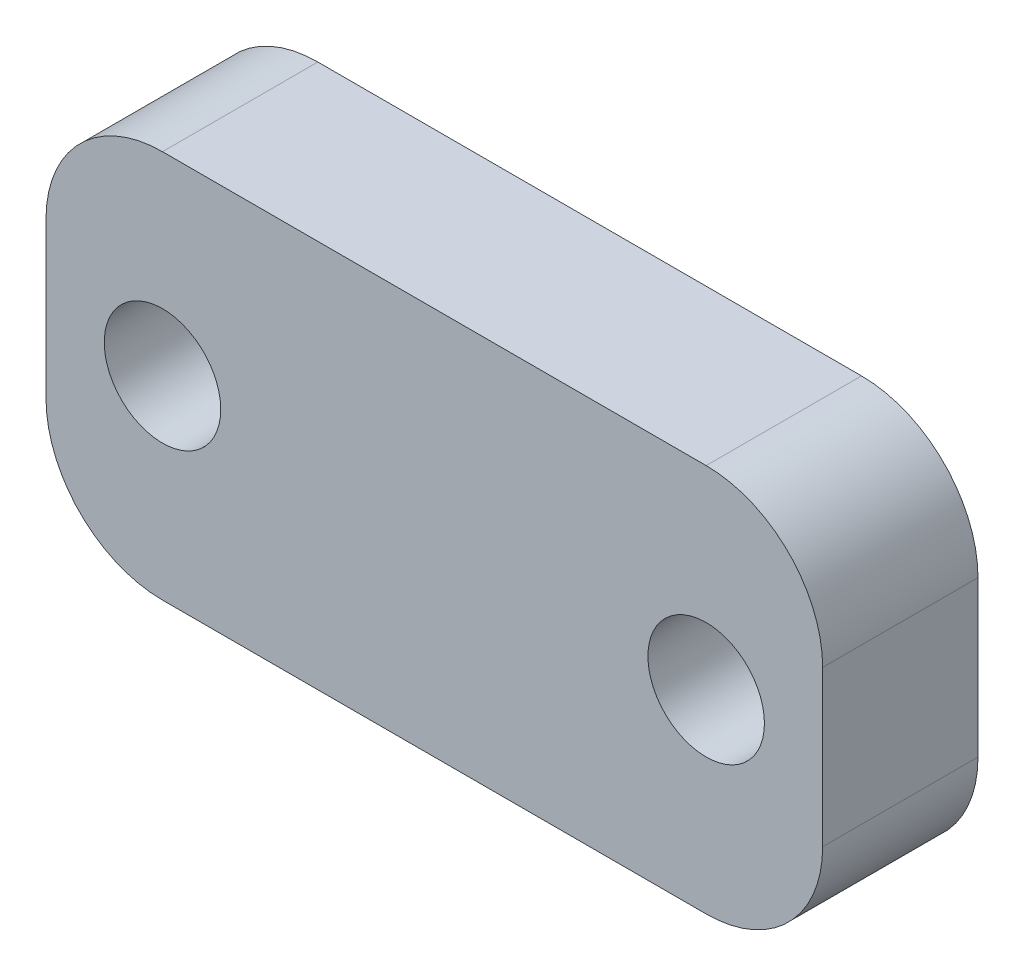
from build123d import *

# Parameters (mm, degrees)
SKETCH_1_R      = 1.5
EXTRUDE_1_DEPTH = 4


with BuildPart() as part:
    # 草图1 → 凸台-拉伸1 (new body)
    with BuildSketch(Plane.XY):
        with BuildLine():
            Line((-7, 5), (7, 5))
            ThreePointArc((7, 5), (9.121320344, 4.121320344), (10, 2))
            Line((10, 2), (10, -2))
            ThreePointArc((10, -2), (9.121320344, -4.121320344), (7, -5))
            Line((7, -5), (-7, -5))
            ThreePointArc((-7, -5), (-9.121320344, -4.121320344), (-10, -2))
            Line((-10, -2), (-10, 2))
            ThreePointArc((-10, 2), (-9.121320344, 4.121320344), (-7, 5))
        make_face()
        with Locations((-7, 0)):
            Circle(SKETCH_1_R, mode=Mode.SUBTRACT)
        with Locations((7, 0)):
            Circle(SKETCH_1_R, mode=Mode.SUBTRACT)
    extrude(amount=EXTRUDE_1_DEPTH)


solid = part.part
